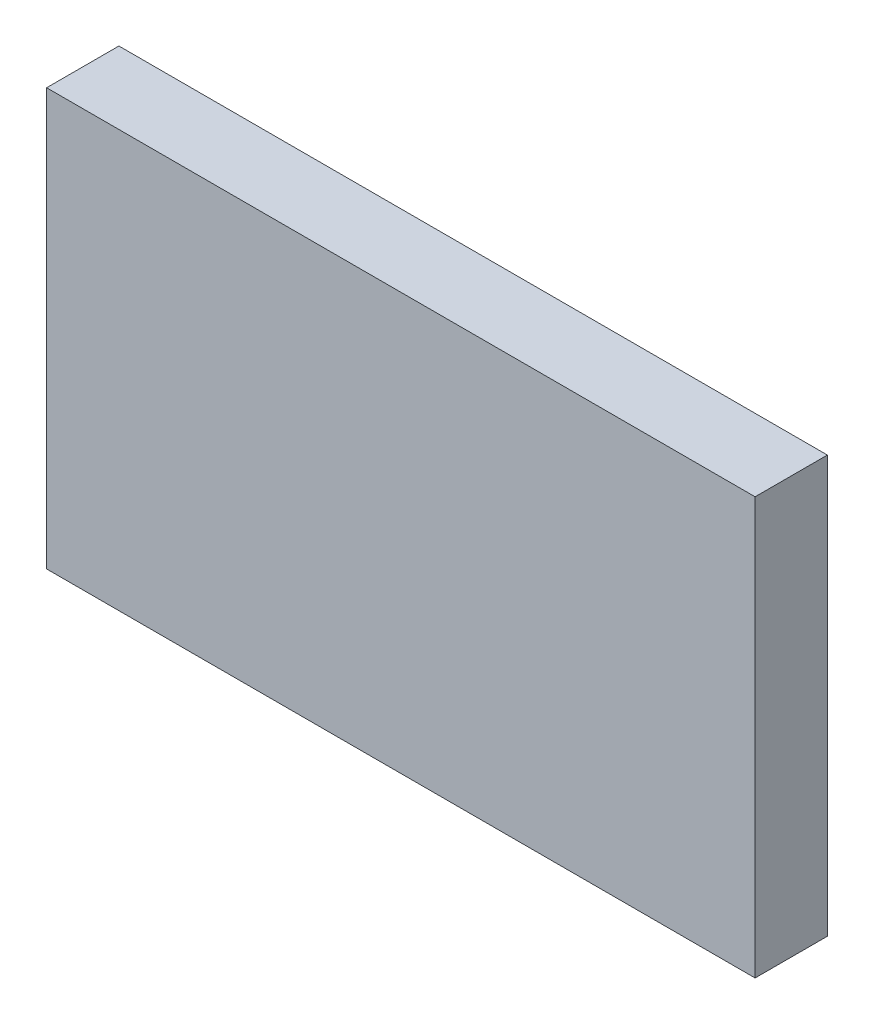
from build123d import *

# Parameters (mm, degrees)
ESQUISSE1_W        = 98.008093776
ESQUISSE1_H        = 57.651819868
BOSS_EXTRU_1_DEPTH = 10


with BuildPart() as part:
    # Esquisse1 → Boss.-Extru.1 (new body)
    with BuildSketch(Plane.XY):
        with Locations((-56.125742283, 31.538936751)):
            Rectangle(ESQUISSE1_W, ESQUISSE1_H)
    extrude(amount=BOSS_EXTRU_1_DEPTH)


solid = part.part
